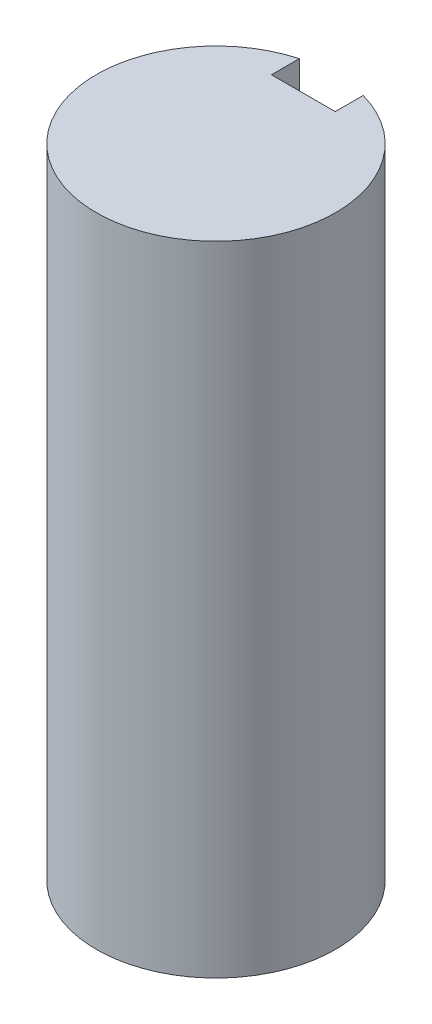
from build123d import *

# Parameters (mm, degrees)
SKETCH1_R           = 15
BOSS_EXTRUDE1_DEPTH = 80
SKETCH2_W           = 8
SKETCH2_H           = 3.5
CUT_EXTRUDE2_DEPTH  = 83.764726786
SKETCH5_W           = 8.467594852
SKETCH5_H           = 0.933653361
CUT_EXTRUDE3_DEPTH  = 83.764726786


with BuildPart() as part:
    # Sketch1 → Boss-Extrude1 (new body)
    with BuildSketch(Plane(origin=(0, 0, 0), x_dir=(1, 0, 0), z_dir=(0, 1, 0))):
        with Locations(Location((0, 0, 0), (0, 0, 270))):
            Circle(SKETCH1_R)
    extrude(amount=BOSS_EXTRUDE1_DEPTH)

    # Sketch2 → Cut-Extrude2 (cut, through all)
    with BuildSketch(Plane(origin=(0, 80, 0), x_dir=(1, 0, 0), z_dir=(0, 1, 0))):
        with Locations((0, 12.706832295)):
            Rectangle(SKETCH2_W, SKETCH2_H)
    extrude(amount=-CUT_EXTRUDE2_DEPTH, mode=Mode.SUBTRACT)

    # Sketch5 → Cut-Extrude3 (cut, through all)
    with BuildSketch(Plane(origin=(0, 80, 0), x_dir=(1, 0, 0), z_dir=(0, 1, 0))):
        with Locations((0.233797426, 14.923658976)):
            Rectangle(SKETCH5_W, SKETCH5_H)
    extrude(amount=-CUT_EXTRUDE3_DEPTH, mode=Mode.SUBTRACT)


solid = part.part
